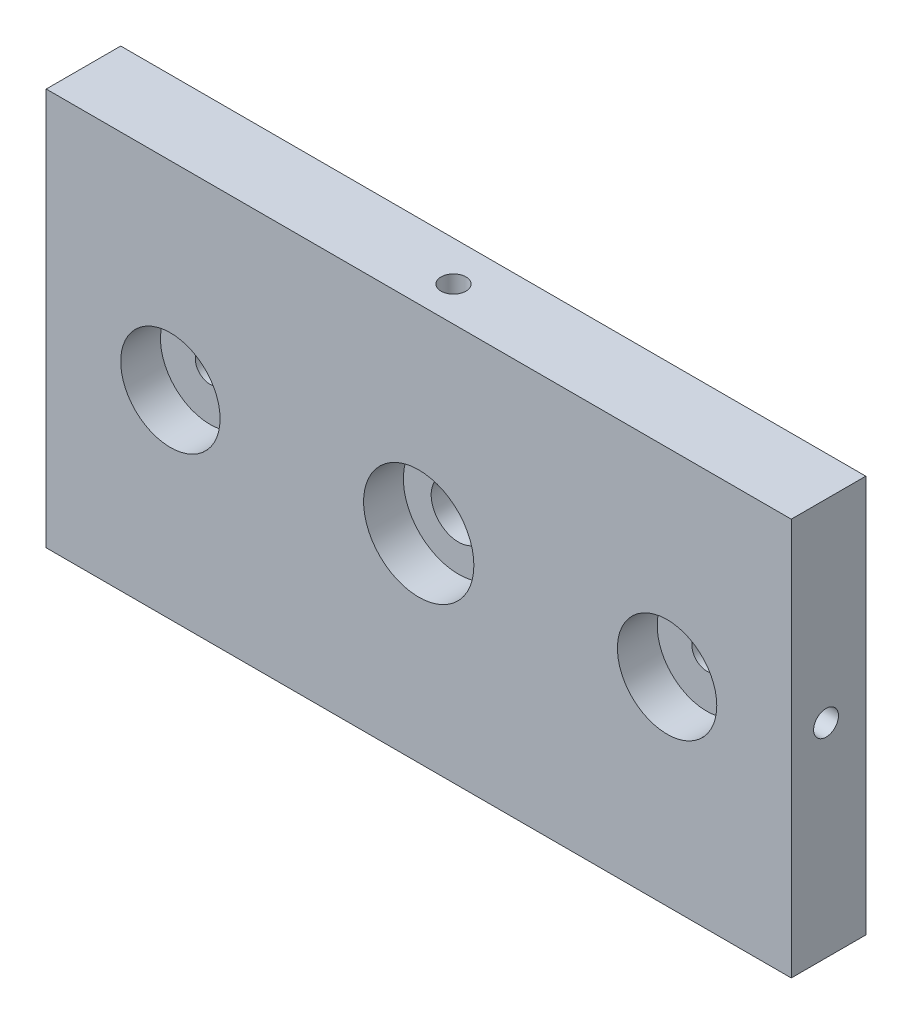
from build123d import *

# Parameters (mm, degrees)
SKETCH1_W           = 150
SKETCH1_H           = 80
BOSS_EXTRUDE1_DEPTH = 15
CUT_EXTRUDE1_REACH  = 88.313
SKETCH2_R           = 3
SKETCH2_R_2         = 5.5
SKETCH3_R           = 11.1
SKETCH3_R_2         = 10
CUT_EXTRUDE2_DEPTH  = 8
SKETCH5_R           = 5
CUT_EXTRUDE4_DEPTH  = 4
SKETCH6_R           = 2.5
CUT_EXTRUDE5_DEPTH  = 10
SKETCH7_R           = 2.5
CUT_EXTRUDE6_DEPTH  = 10
SKETCH8_R           = 2.5
CUT_EXTRUDE7_DEPTH  = 10


with BuildPart() as part:
    # Sketch1 → Boss-Extrude1 (new body)
    with BuildSketch(Plane.XY):
        Rectangle(SKETCH1_W, SKETCH1_H)
    extrude(amount=BOSS_EXTRUDE1_DEPTH)

    # Sketch2 → Cut-Extrude1 (cut, up to next)
    with BuildSketch(Plane.XY.offset(15), mode=Mode.PRIVATE) as cut_extrude1_sk1:
        with Locations((-50, 0)):
            Circle(SKETCH2_R)
    cut_extrude1_tool1 = extrude(cut_extrude1_sk1.sketch, amount=-CUT_EXTRUDE1_REACH, mode=Mode.PRIVATE) & part.part
    # Sketch2 → Cut-Extrude1 (cut, up to next)
    with BuildSketch(Plane.XY.offset(15), mode=Mode.PRIVATE) as cut_extrude1_sk2:
        with Locations((50, 0)):
            Circle(SKETCH2_R)
    cut_extrude1_tool2 = extrude(cut_extrude1_sk2.sketch, amount=-CUT_EXTRUDE1_REACH, mode=Mode.PRIVATE) & part.part
    # Sketch2 → Cut-Extrude1 (cut, up to next)
    with BuildSketch(Plane.XY.offset(15), mode=Mode.PRIVATE) as cut_extrude1_sk3:
        Circle(SKETCH2_R_2)
    cut_extrude1_tool3 = extrude(cut_extrude1_sk3.sketch, amount=-CUT_EXTRUDE1_REACH, mode=Mode.PRIVATE) & part.part
    add(cut_extrude1_tool1.solids().sort_by_distance((-50, 0, 15))[0], mode=Mode.SUBTRACT)
    add(cut_extrude1_tool2.solids().sort_by_distance((50, 0, 15))[0], mode=Mode.SUBTRACT)
    add(cut_extrude1_tool3.solids().sort_by_distance((0, 0, 15))[0], mode=Mode.SUBTRACT)

    # Sketch3 → Cut-Extrude2 (cut)
    with BuildSketch(Plane.XY.offset(15)):
        Circle(SKETCH3_R)
        with Locations((-50, 0)):
            Circle(SKETCH3_R_2)
        with Locations((50, 0)):
            Circle(SKETCH3_R_2)
    extrude(amount=-CUT_EXTRUDE2_DEPTH, mode=Mode.SUBTRACT)

    # Sketch5 → Cut-Extrude4 (cut)
    with BuildSketch(Plane(origin=(0, 0, 0), x_dir=(-1, 0, 0), z_dir=(0, 0, -1))):
        with Locations((-50, 0)):
            Circle(SKETCH5_R)
        with Locations((50, 0)):
            Circle(SKETCH5_R)
    extrude(amount=-CUT_EXTRUDE4_DEPTH, mode=Mode.SUBTRACT)

    # Sketch6 → Cut-Extrude5 (cut)
    with BuildSketch(Plane.ZY.offset(75)):
        with Locations((8, 1)):
            Circle(SKETCH6_R)
    cut_extrude5 = extrude(amount=-CUT_EXTRUDE5_DEPTH, mode=Mode.SUBTRACT)

    # Mirror1: Cut-Extrude5 across plane
    add(cut_extrude5.mirror(Plane(origin=(0, 0, 0), x_dir=(0, 0, 1), z_dir=(1, 0, 0))), mode=Mode.SUBTRACT)

    # Sketch7 → Cut-Extrude6 (cut)
    with BuildSketch(Plane.XZ.offset(40)):
        with Locations((-62, 8)):
            Circle(SKETCH7_R)
        with Locations(Location((62, 8, 0), (0, 0, 180))):
            Circle(SKETCH7_R)
    extrude(amount=-CUT_EXTRUDE6_DEPTH, mode=Mode.SUBTRACT)

    # Sketch8 → Cut-Extrude7 (cut)
    with BuildSketch(Plane(origin=(0, 40, 0), x_dir=(1, 0, 0), z_dir=(0, 1, 0))):
        with Locations(Location((0, -8, 0), (0, 0, 180))):
            Circle(SKETCH8_R)
    extrude(amount=-CUT_EXTRUDE7_DEPTH, mode=Mode.SUBTRACT)


solid = part.part
